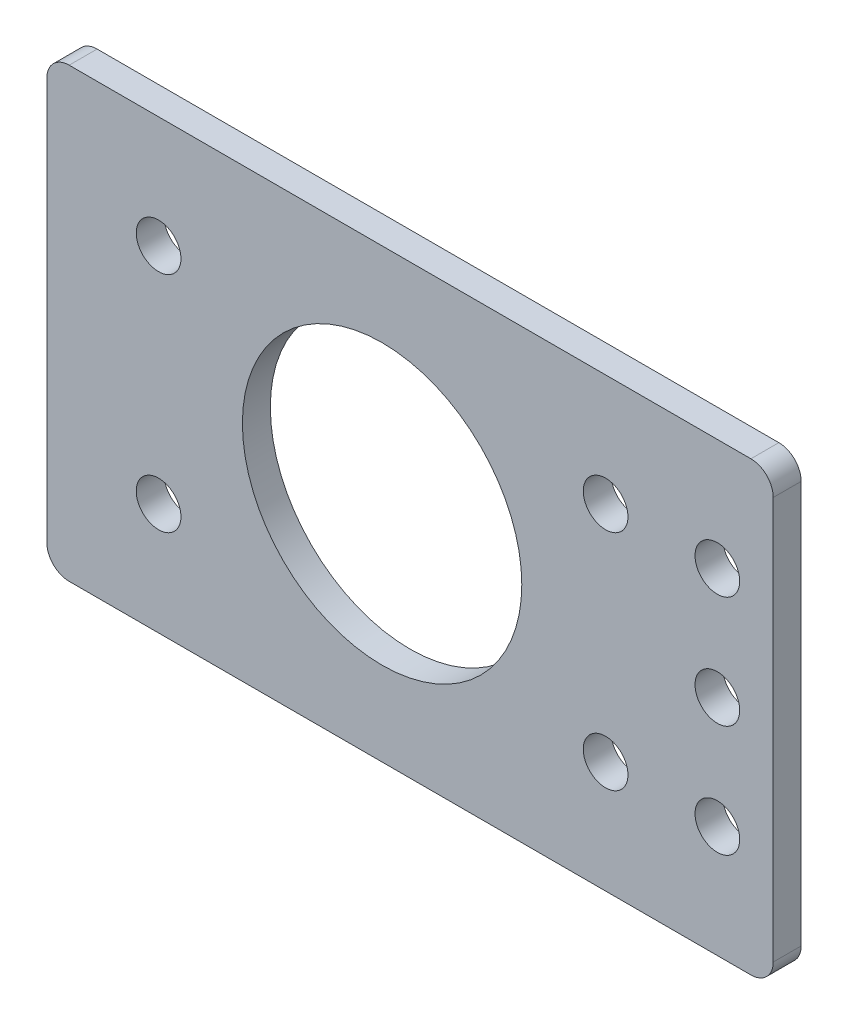
from build123d import *

# Parameters (mm, degrees)
SKETCH2_R           = 15.875
SKETCH2_R_2         = 2.54
BOSS_EXTRUDE1_DEPTH = 3.175
FILLET1_R           = 2.54
SKETCH4_OUTSIDE_W   = 171.436
SKETCH4_OUTSIDE_H   = 82.536
SKETCH4_OUTSIDE_W_2 = 82.55
SKETCH4_OUTSIDE_H_2 = 50.8
CUT_EXTRUDE1_DEPTH  = 509.64451302
FILLET2_R           = 2.54


with BuildPart() as part:
    # Sketch2 → Boss-Extrude1 (new body)
    with BuildSketch(Plane.XY):
        Polygon((-508, 25.4), (-481.624580264, 25.4), (-457.99375, 25.4), (-431.8, 25.4), (-368.3, 25.4), (-368.3, -25.4), (-431.8, -25.4), (-457.99375, -25.4), (-481.624580264, -25.4), (-508, -25.4), align=None)
        with Locations((-469.9, 0)):
            Circle(SKETCH2_R, mode=Mode.SUBTRACT)
        with Locations((-495.3, 12.7)):
            Circle(SKETCH2_R_2, mode=Mode.SUBTRACT)
        with Locations((-495.3, -12.7)):
            Circle(SKETCH2_R_2, mode=Mode.SUBTRACT)
        with Locations((-444.5, -12.7)):
            Circle(SKETCH2_R_2, mode=Mode.SUBTRACT)
        with Locations((-431.8, -12.7)):
            Circle(SKETCH2_R_2, mode=Mode.SUBTRACT)
        with Locations((-419.1, -12.7)):
            Circle(SKETCH2_R_2, mode=Mode.SUBTRACT)
        with Locations((-419.1, 0)):
            Circle(SKETCH2_R_2, mode=Mode.SUBTRACT)
        with Locations((-431.8, 0)):
            Circle(SKETCH2_R_2, mode=Mode.SUBTRACT)
        with Locations((-431.8, 12.7)):
            Circle(SKETCH2_R_2, mode=Mode.SUBTRACT)
        with Locations((-419.1, 12.7)):
            Circle(SKETCH2_R_2, mode=Mode.SUBTRACT)
        with Locations((-444.5, 12.7)):
            Circle(SKETCH2_R_2, mode=Mode.SUBTRACT)
        with Locations((-406.4, 12.7)):
            Circle(SKETCH2_R_2, mode=Mode.SUBTRACT)
        with Locations((-406.4, 0)):
            Circle(SKETCH2_R_2, mode=Mode.SUBTRACT)
        with Locations((-406.4, -12.7)):
            Circle(SKETCH2_R_2, mode=Mode.SUBTRACT)
        with Locations((-393.7, 12.7)):
            Circle(SKETCH2_R_2, mode=Mode.SUBTRACT)
        with Locations((-393.7, 0)):
            Circle(SKETCH2_R_2, mode=Mode.SUBTRACT)
        with Locations((-393.7, -12.7)):
            Circle(SKETCH2_R_2, mode=Mode.SUBTRACT)
        with Locations((-381, 12.7)):
            Circle(SKETCH2_R_2, mode=Mode.SUBTRACT)
        with Locations((-381, 0)):
            Circle(SKETCH2_R_2, mode=Mode.SUBTRACT)
        with Locations((-381, -12.7)):
            Circle(SKETCH2_R_2, mode=Mode.SUBTRACT)
    extrude(amount=BOSS_EXTRUDE1_DEPTH)

    # Fillet1
    fillet1_edges = [part.edges().sort_by_distance(p)[0] for p in [
        (-508, 25.4, 1.5875),
        (-368.3, 25.4, 1.5875),
        (-368.3, -25.4, 1.5875),
        (-508, -25.4, 1.5875),
    ]]
    fillet(fillet1_edges, radius=FILLET1_R)

    # Sketch4 outside → Cut-Extrude1 (cut, through all)
    with BuildSketch(Plane.XY.offset(3.175)):
        with Locations((-438.15, 0)):
            Rectangle(SKETCH4_OUTSIDE_W, SKETCH4_OUTSIDE_H)
        with Locations((-466.725, 0)):
            Rectangle(SKETCH4_OUTSIDE_W_2, SKETCH4_OUTSIDE_H_2, mode=Mode.SUBTRACT)
    extrude(amount=-CUT_EXTRUDE1_DEPTH, mode=Mode.SUBTRACT)

    # Fillet2
    fillet2_edges = [part.edges().sort_by_distance(p)[0] for p in [
        (-425.45, 25.4, 1.5875),
        (-425.45, -25.4, 1.5875),
    ]]
    fillet(fillet2_edges, radius=FILLET2_R)


solid = part.part
